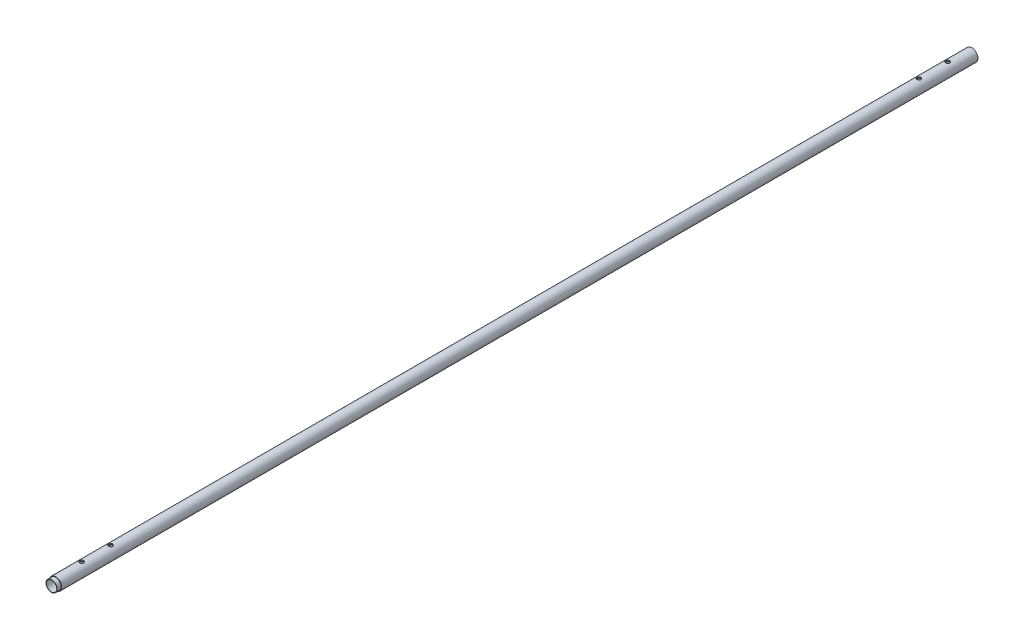
from build123d import *

# Parameters (mm, degrees)
SKETCH1_R               = 10.65
SKETCH1_R_2             = 9
BOSS_EXTRUDE1_DEPTH     = 1594
CUT_EXTRUDE1_DEPTH      = 1595.071154309
CUT_EXTRUDE1_DEPTH_BACK = 1595.071154309
SKETCH2_R               = 3.5
SKETCH3_W               = 7
SKETCH3_H               = 1


with BuildPart() as part:
    # Sketch1 → Boss-Extrude1 (new body)
    with BuildSketch(Plane.XY):
        Circle(SKETCH1_R)
        Circle(SKETCH1_R_2, mode=Mode.SUBTRACT)
    extrude(amount=BOSS_EXTRUDE1_DEPTH)

    # Sketch2 → Cut-Extrude1 (cut, two sides: drawn at the far end of the back side and taken through both)
    with BuildSketch(Plane(origin=(0, 0, 0), x_dir=(1, 0, 0), z_dir=(0, 1, 0)).offset(-CUT_EXTRUDE1_DEPTH_BACK)):
        with Locations(Location((0, -1542, 0), (0, 0, 270))):
            Circle(SKETCH2_R)
        with Locations(Location((0, -1492, 0), (0, 0, 270))):
            Circle(SKETCH2_R)
        with Locations(Location((0, -42, 0), (0, 0, 270))):
            Circle(SKETCH2_R)
        with Locations(Location((0, -92, 0), (0, 0, 270))):
            Circle(SKETCH2_R)
    extrude(amount=CUT_EXTRUDE1_DEPTH + CUT_EXTRUDE1_DEPTH_BACK, mode=Mode.SUBTRACT)

    # Sketch3 → Cut-Revolve1 (revolve, cut)
    with BuildSketch(Plane(origin=(0, 0, 0), x_dir=(0, 0, -1), z_dir=(1, 0, 0)), mode=Mode.PRIVATE) as cut_revolve1_sk:
        with Locations((-1590.5, 10.15)):
            Rectangle(SKETCH3_W, SKETCH3_H)
    revolve(cut_revolve1_sk.sketch.rotate(Axis((0, 0, 1594), (0, 0, -1)), 180), axis=Axis((0, 0, 1594), (0, 0, -1)), mode=Mode.SUBTRACT)


solid = part.part
